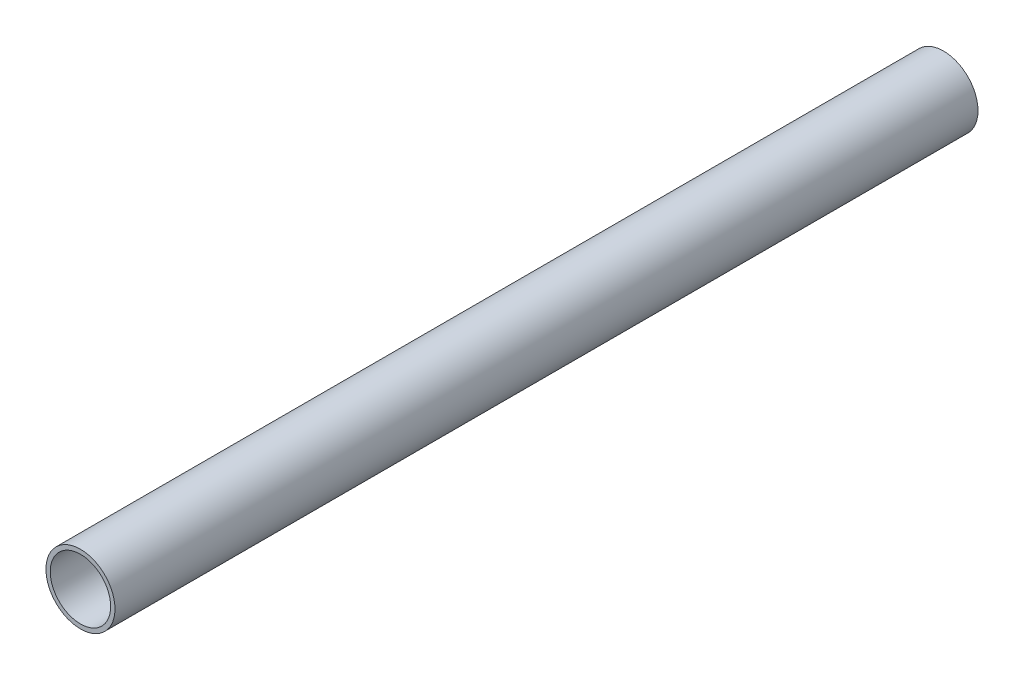
from build123d import *

# Parameters (mm, degrees)
IZIM1_R                     = 8
IZIM1_R_2                   = 7
Y_KSEKLIK_EKSTR_ZYON1_DEPTH = 200


with BuildPart() as part:
    # Çizim1 → Yükseklik-Ekstrüzyon1 (new body)
    with BuildSketch(Plane.XY):
        Circle(IZIM1_R)
        Circle(IZIM1_R_2, mode=Mode.SUBTRACT)
    extrude(amount=Y_KSEKLIK_EKSTR_ZYON1_DEPTH)


solid = part.part
